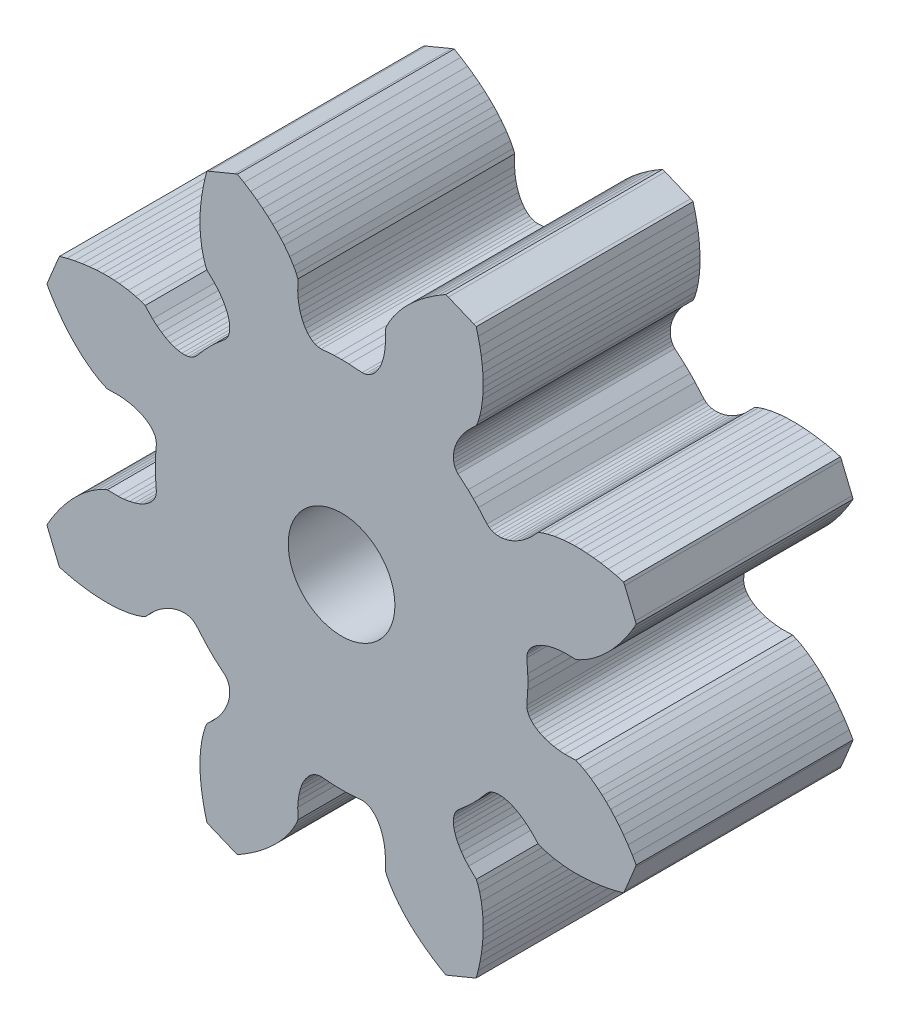
from build123d import *

# Parameters (mm, degrees)
SKETCH1_R           = 1.25
BOSS_EXTRUDE1_DEPTH = 5.08


with BuildPart() as part:
    # Sketch1 → Boss-Extrude1 (new body)
    with BuildSketch(Plane.XY):
        Polygon((-9.716102852, 12.188534649), (-9.756411985, 12.37313879), (-9.787228024, 12.549856362), (-9.809573304, 12.717080842), (-9.824616205, 12.876272704), (-9.831626488, 13.025971474), (-9.832502774, 13.166323199), (-9.827829251, 13.297035783), (-9.818336159, 13.418255275), (-9.788834547, 13.629001933), (-9.750131939, 13.798563173), (-9.709822807, 13.92854552), (-9.672434626, 14.018072687), (-9.490897484, 14.193913973), (-9.399909841, 14.298484041), (-9.322942767, 14.40232387), (-9.260434402, 14.504557176), (-9.210632177, 14.604453721), (-9.173243997, 14.701137219), (-9.148708003, 14.793001147), (-9.136732102, 14.880191553), (-9.136001864, 14.960955864), (-9.146225194, 15.034709892), (-9.167840236, 15.101161542), (-9.198656276, 15.159872669), (-9.243784978, 15.214494464), (-9.479213677, 15.417354553), (-9.601893645, 15.536237283), (-9.71990009, 15.659063298), (-9.923636464, 15.893615712), (-9.978404307, 15.939474652), (-10.036093101, 15.970436739), (-10.102690797, 15.991029448), (-10.176298778, 16.001398826), (-10.257209137, 16.001398826), (-10.34454559, 15.988692687), (-10.436409518, 15.964156693), (-10.532946969, 15.927644798), (-10.632697466, 15.877696526), (-10.734930772, 15.814311876), (-10.839646887, 15.737490849), (-10.943486717, 15.647233444), (-11.119328003, 15.464966064), (-11.20885517, 15.428454169), (-11.338837516, 15.387268751), (-11.508398757, 15.348420095), (-11.720021701, 15.319064531), (-11.840510955, 15.309571438), (-11.971077491, 15.304897916), (-12.111283168, 15.306504439), (-12.261127986, 15.313514723), (-12.420319848, 15.327827386), (-12.588274565, 15.350026618), (-12.764261899, 15.380988705), (-12.948719993, 15.421297837), (-13.122370566, 15.467302825), (-13.150265654, 15.525867905), (-13.396501874, 16.120135509), (-13.417970869, 16.180453159), (-13.327713464, 16.335701737), (-13.226356443, 16.495039647), (-13.123246852, 16.64152537), (-13.02013726, 16.775451001), (-12.917903954, 16.898277016), (-12.817277171, 17.009273177), (-12.718402959, 17.109023674), (-12.622449699, 17.198550841), (-12.530585771, 17.277124439), (-12.360878483, 17.405500262), (-12.213516474, 17.498240476), (-12.09244303, 17.560602793), (-12.003500054, 17.598867259), (-11.749961455, 17.593901641), (-11.612238587, 17.604271019), (-11.484739049, 17.623403252), (-11.367170747, 17.651006245), (-11.261870442, 17.685765569), (-11.167669752, 17.727827272), (-11.085298917, 17.776315069), (-11.014611888, 17.828454055), (-10.956923094, 17.885558659), (-10.911648344, 17.945876309), (-10.879956019, 18.007508388), (-10.860969834, 18.0701628), (-10.854689788, 18.140849829), (-10.87688902, 18.451346984), (-10.879956019, 18.62178451), (-10.87688902, 18.791929941), (-10.854689788, 19.101842907), (-10.860969834, 19.173114126), (-10.879956019, 19.235768538), (-10.911648344, 19.297692712), (-10.956923094, 19.357864315), (-11.014611888, 19.414092633), (-11.085298917, 19.467253952), (-11.167669752, 19.514719416), (-11.261870442, 19.556635072), (-11.367170747, 19.592416729), (-11.484739049, 19.620165769), (-11.612238587, 19.639005907), (-11.749961455, 19.648499), (-12.003500054, 19.644701762), (-12.09244303, 19.681797848), (-12.213516474, 19.745328545), (-12.360878483, 19.838068759), (-12.530585771, 19.966444582), (-12.622449699, 20.044726085), (-12.718402959, 20.134399299), (-12.817277171, 20.233273511), (-12.917903954, 20.344269672), (-13.02013726, 20.467825925), (-13.123246852, 20.601751556), (-13.226356443, 20.748383326), (-13.327713464, 20.907575189), (-13.417970869, 21.062093529), (-13.396501874, 21.123287465), (-13.150265654, 21.718139259), (-13.122370566, 21.775974101), (-12.948719993, 21.821979088), (-12.764261899, 21.862434268), (-12.588274565, 21.893396355), (-12.420319848, 21.91544954), (-12.261127986, 21.929762203), (-12.111283168, 21.936772487), (-11.971077491, 21.937648772), (-11.840510955, 21.932975249), (-11.720021701, 21.924212395), (-11.508398757, 21.893980546), (-11.338837516, 21.856154222), (-11.20885517, 21.814968805), (-11.119328003, 21.77845691), (-10.943486717, 21.596189529), (-10.839646887, 21.505786077), (-10.734930772, 21.42896505), (-10.632697466, 21.3655804), (-10.532946969, 21.315778175), (-10.436409518, 21.278389995), (-10.34454559, 21.254730287), (-10.257209137, 21.242024147), (-10.176298778, 21.241293909), (-10.102690797, 21.252247478), (-10.036093101, 21.272840187), (-9.978404307, 21.303802274), (-9.923636464, 21.349807262), (-9.71990009, 21.584213628), (-9.601893645, 21.70718569), (-9.479213677, 21.825192135), (-9.243784978, 22.02892851), (-9.198656276, 22.083550305), (-9.167840236, 22.141239099), (-9.146225194, 22.207836795), (-9.136001864, 22.282467109), (-9.136732102, 22.363231421), (-9.148708003, 22.450421826), (-9.173243997, 22.542285754), (-9.210632177, 22.638823205), (-9.260434402, 22.738865797), (-9.322942767, 22.840953056), (-9.399909841, 22.944792885), (-9.490897484, 23.049362953), (-9.672434626, 23.225350287), (-9.709822807, 23.314731406), (-9.750131939, 23.444713752), (-9.788834547, 23.614274993), (-9.818336159, 23.825167699), (-9.827829251, 23.945510905), (-9.832502774, 24.077099775), (-9.831626488, 24.217451499), (-9.824616205, 24.366273984), (-9.809573304, 24.526342132), (-9.787228024, 24.693420563), (-9.756411985, 24.870138135), (-9.716102852, 25.054158087), (-9.670828103, 25.22839285), (-9.612993261, 25.25614189), (-9.017849371, 25.502670205), (-8.957093578, 25.523847105), (-8.801698953, 25.432859462), (-8.643237328, 25.331356394), (-8.496605558, 25.22839285), (-8.361949689, 25.126159544), (-8.239123674, 25.023049952), (-8.12827356, 24.922423169), (-8.028377015, 24.824279195), (-7.938703801, 24.728325935), (-7.860276251, 24.636462007), (-7.732046475, 24.466024481), (-7.639306262, 24.31880852), (-7.57665185, 24.198319266), (-7.539409717, 24.108646052), (-7.543353001, 23.855983738), (-7.533859909, 23.71826087), (-7.513997438, 23.589739), (-7.487270731, 23.473339078), (-7.451489073, 23.36701644), (-7.409573418, 23.27281575), (-7.361085621, 23.190444915), (-7.308946635, 23.119757886), (-7.251695984, 23.06279933), (-7.192254619, 23.017816675), (-7.13062254, 22.985102017), (-7.067091842, 22.96626188), (-6.996696909, 22.959689738), (-6.686783943, 22.982035018), (-6.515762227, 22.985102017), (-6.345470748, 22.982035018), (-6.035411736, 22.959689738), (-5.965016802, 22.96626188), (-5.901632152, 22.985102017), (-5.839707978, 23.017816675), (-5.780558708, 23.06279933), (-5.723308057, 23.119757886), (-5.670292785, 23.190444915), (-5.622681274, 23.27281575), (-5.580765618, 23.36701644), (-5.544983961, 23.473339078), (-5.517380968, 23.589739), (-5.498394783, 23.71826087), (-5.488755643, 23.855983738), (-5.492844975, 24.108646052), (-5.455602842, 24.198319266), (-5.392802383, 24.31880852), (-5.300208217, 24.466024481), (-5.171978441, 24.636462007), (-5.092674605, 24.728325935), (-5.003731629, 24.824279195), (-4.903981132, 24.922423169), (-4.792984971, 25.023049952), (-4.670305003, 25.126159544), (-4.535649134, 25.22839285), (-4.389017364, 25.331356394), (-4.230555739, 25.432859462), (-4.075161114, 25.523847105), (-4.014989511, 25.502670205), (-3.419991669, 25.25614189), (-3.361426589, 25.22839285), (-3.316151839, 25.054158087), (-3.275842707, 24.870138135), (-3.244150382, 24.693420563), (-3.221805102, 24.526342132), (-3.207638487, 24.366273984), (-3.200482156, 24.217451499), (-3.199751918, 24.077099775), (-3.20442544, 23.945510905), (-3.213918533, 23.825167699), (-3.243274097, 23.614274993), (-3.281246468, 23.444713752), (-3.322431885, 23.314731406), (-3.359820066, 23.225350287), (-3.541065113, 23.049362953), (-3.63234485, 22.944792885), (-3.70843564, 22.840953056), (-3.771674242, 22.738865797), (-3.821622514, 22.638823205), (-3.859010695, 22.542285754), (-3.883546688, 22.450421826), (-3.89552259, 22.363231421), (-3.89610678, 22.282467109), (-3.88588345, 22.207836795), (-3.864414455, 22.141239099), (-3.833598416, 22.083550305), (-3.788323666, 22.02892851), (-3.553041014, 21.825192135), (-3.430361047, 21.70718569), (-3.312354602, 21.584213628), (-3.108618228, 21.349807262), (-3.053850385, 21.303802274), (-2.996015543, 21.272840187), (-2.929563894, 21.252247478), (-2.855955914, 21.241293909), (-2.774169269, 21.242024147), (-2.687709102, 21.254730287), (-2.594968888, 21.278389995), (-2.499307723, 21.315778175), (-2.399557226, 21.3655804), (-2.296447634, 21.42896505), (-2.192607805, 21.505786077), (-2.08789169, 21.596189529), (-1.912926688, 21.77845691), (-1.823399522, 21.814968805), (-1.693417175, 21.856154222), (-1.522979649, 21.893980546), (-1.312232991, 21.924212395), (-1.191743737, 21.932975249), (-1.061177201, 21.937648772), (-0.920825476, 21.936772487), (-0.771126706, 21.929762203), (-0.611058558, 21.91544954), (-0.443834079, 21.893396355), (-0.267992792, 21.862434268), (-0.083388651, 21.821979088), (0.090261922, 21.775974101), (0.118010962, 21.718139259), (0.364247182, 21.123287465), (0.385716177, 21.062093529), (0.295458772, 20.907575189), (0.194101752, 20.748383326), (0.09099216, 20.601751556), (-0.011971384, 20.467825925), (-0.11420469, 20.344269672), (-0.214831473, 20.233273511), (-0.313851733, 20.134399299), (-0.409804993, 20.044726085), (-0.501668921, 19.966444582), (-0.671230161, 19.838068759), (-0.818738217, 19.745328545), (-0.939811661, 19.681797848), (-1.02860859, 19.644701762), (-1.282293237, 19.648499), (-1.420016105, 19.639005907), (-1.547515643, 19.620165769), (-1.66479185, 19.592416729), (-1.770238203, 19.556635072), (-1.864584939, 19.514719416), (-1.946955775, 19.467253952), (-2.017496756, 19.414092633), (-2.075331598, 19.357864315), (-2.119730062, 19.297692712), (-2.152152625, 19.235768538), (-2.171284858, 19.173114126), (-2.177564904, 19.101842907), (-2.155219624, 18.791929941), (-2.152152625, 18.62178451), (-2.155219624, 18.451346984), (-2.177564904, 18.140849829), (-2.171284858, 18.0701628), (-2.152152625, 18.007508388), (-2.119730062, 17.945876309), (-2.075331598, 17.885558659), (-2.017496756, 17.828454055), (-1.946955775, 17.776315069), (-1.864584939, 17.727827272), (-1.770238203, 17.685765569), (-1.66479185, 17.651006245), (-1.547515643, 17.623403252), (-1.420016105, 17.604271019), (-1.282293237, 17.593901641), (-1.02860859, 17.598867259), (-0.939811661, 17.560602793), (-0.818738217, 17.498240476), (-0.671230161, 17.405500262), (-0.501668921, 17.277124439), (-0.409804993, 17.198550841), (-0.313851733, 17.109023674), (-0.214831473, 17.009273177), (-0.11420469, 16.898277016), (-0.011971384, 16.775451001), (0.09099216, 16.64152537), (0.194101752, 16.495039647), (0.295458772, 16.335701737), (0.385716177, 16.180453159), (0.364247182, 16.120135509), (0.118010962, 15.525867905), (0.090261922, 15.467302825), (-0.083388651, 15.421297837), (-0.267992792, 15.380988705), (-0.443834079, 15.350026618), (-0.611058558, 15.327827386), (-0.771126706, 15.313514723), (-0.920825476, 15.306504439), (-1.061177201, 15.304897916), (-1.191743737, 15.309571438), (-1.312232991, 15.319064531), (-1.522979649, 15.348420095), (-1.693417175, 15.387268751), (-1.823399522, 15.428454169), (-1.912926688, 15.464966064), (-2.08789169, 15.647233444), (-2.192607805, 15.737490849), (-2.296447634, 15.814311876), (-2.399557226, 15.877696526), (-2.499307723, 15.927644798), (-2.594968888, 15.964156693), (-2.687709102, 15.988692687), (-2.774169269, 16.001398826), (-2.855955914, 16.001398826), (-2.929563894, 15.991029448), (-2.996015543, 15.970436739), (-3.053850385, 15.939474652), (-3.108618228, 15.893615712), (-3.312354602, 15.659063298), (-3.430361047, 15.536237283), (-3.553041014, 15.417354553), (-3.788323666, 15.214494464), (-3.833598416, 15.159872669), (-3.864414455, 15.101161542), (-3.88588345, 15.034709892), (-3.89610678, 14.960955864), (-3.89552259, 14.880191553), (-3.883546688, 14.793001147), (-3.859010695, 14.701137219), (-3.821622514, 14.604453721), (-3.771674242, 14.504557176), (-3.70843564, 14.40232387), (-3.63234485, 14.298484041), (-3.541065113, 14.193913973), (-3.359820066, 14.018072687), (-3.322431885, 13.92854552), (-3.281246468, 13.798563173), (-3.243274097, 13.629001933), (-3.213918533, 13.418255275), (-3.20442544, 13.297035783), (-3.199751918, 13.166323199), (-3.200482156, 13.025971474), (-3.207638487, 12.876272704), (-3.221805102, 12.717080842), (-3.244150382, 12.549856362), (-3.275842707, 12.37313879), (-3.316151839, 12.188534649), (-3.361426589, 12.015030124), (-3.419991669, 11.987281083), (-4.014989511, 11.741629053), (-4.075161114, 11.719429821), (-4.230555739, 11.809833273), (-4.389017364, 11.911920532), (-4.535649134, 12.014153838), (-4.670305003, 12.11726343), (-4.792984971, 12.220226974), (-4.903981132, 12.320853757), (-5.003731629, 12.419143778), (-5.092674605, 12.514950991), (-5.171978441, 12.606814919), (-5.300208217, 12.777252445), (-5.392802383, 12.923884215), (-5.455602842, 13.045103707), (-5.492844975, 13.134630874), (-5.488755643, 13.387293188), (-5.498394783, 13.525162103), (-5.517380968, 13.652807688), (-5.544983961, 13.770083895), (-5.580765618, 13.876260486), (-5.622681274, 13.970461175), (-5.670292785, 14.052978058), (-5.723308057, 14.122642754), (-5.780558708, 14.180477596), (-5.839707978, 14.225606298), (-5.901632152, 14.257298623), (-5.965016802, 14.277161094), (-6.035411736, 14.28344114), (-6.345470748, 14.261241908), (-6.515762227, 14.257298623), (-6.686783943, 14.261241908), (-6.996696909, 14.28344114), (-7.067091842, 14.277161094), (-7.13062254, 14.257298623), (-7.192254619, 14.225606298), (-7.251695984, 14.180477596), (-7.308946635, 14.122642754), (-7.361085621, 14.052978058), (-7.409573418, 13.970461175), (-7.451489073, 13.876260486), (-7.487270731, 13.770083895), (-7.513997438, 13.652807688), (-7.533859909, 13.525162103), (-7.543353001, 13.387293188), (-7.539409717, 13.134630874), (-7.57665185, 13.045103707), (-7.639306262, 12.923884215), (-7.732046475, 12.777252445), (-7.860276251, 12.606814919), (-7.938703801, 12.514950991), (-8.028377015, 12.419143778), (-8.12827356, 12.320853757), (-8.239123674, 12.220226974), (-8.361949689, 12.11726343), (-8.496605558, 12.014153838), (-8.643237328, 11.911920532), (-8.801698953, 11.809833273), (-8.957093578, 11.719429821), (-9.017849371, 11.741629053), (-9.612993261, 11.987281083), (-9.670828103, 12.015030124), align=None)
        with Locations((-6.516565489, 18.621711487)):
            Circle(SKETCH1_R, mode=Mode.SUBTRACT)
    extrude(amount=BOSS_EXTRUDE1_DEPTH)


solid = part.part
